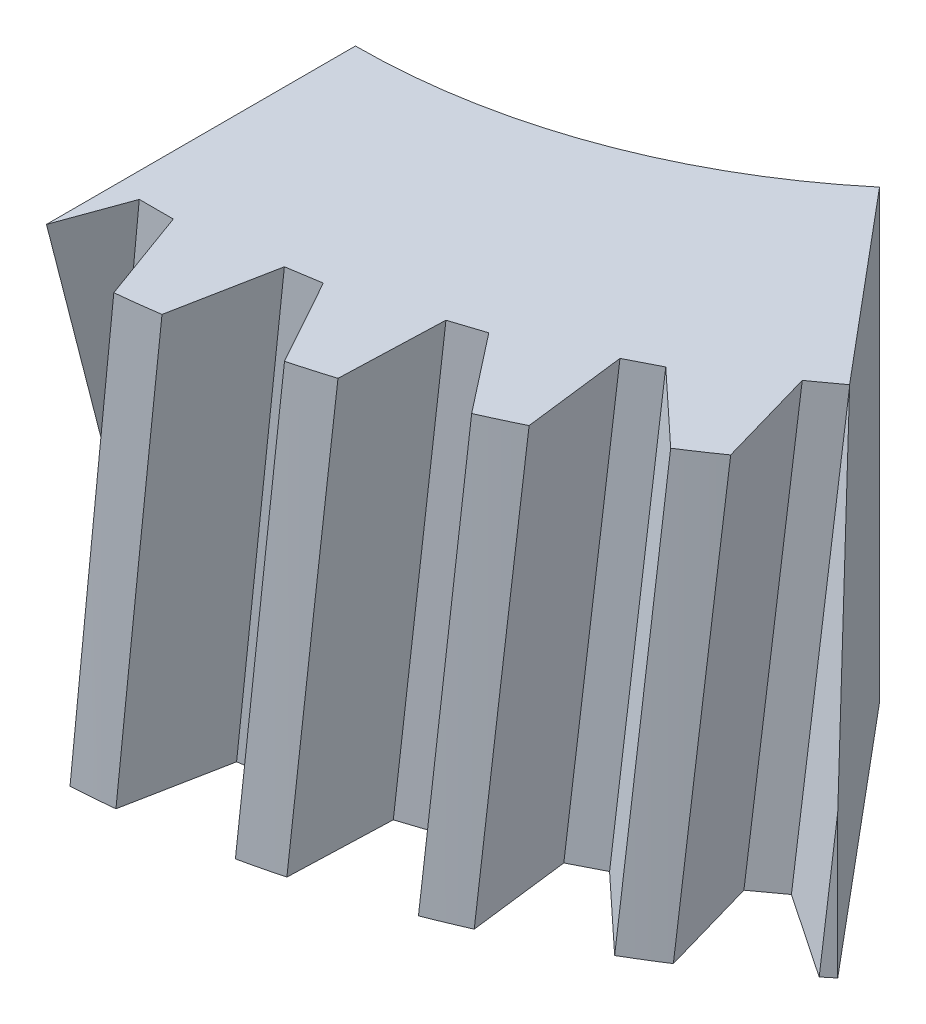
from build123d import *

# Parameters (mm, degrees)
SKETCH_1_R               = 31.5
SKETCH_1_R_2             = 20.1
EXTRUDE_1_DEPTH          = 15
PATTERN_CIRCULAR_4_COUNT = 40
SKETCH_9_OUTSIDE_W       = 83.064
SKETCH_9_OUTSIDE_H       = 83.064
CUT_EXTRUDE_1_DEPTH      = 48.00244519


with BuildPart() as part:
    # Эскиз1 → Бобышка-Вытянуть1 (new body)
    with BuildSketch(Plane(origin=(0, 0, 0), x_dir=(1, 0, 0), z_dir=(0, 1, 0))):
        with Locations(Location((0, 0, 0), (0, 0, 270))):
            Circle(SKETCH_1_R)
        with Locations(Location((0, 0, 0), (0, 0, 270))):
            Circle(SKETCH_1_R_2, mode=Mode.SUBTRACT)
    extrude(amount=EXTRUDE_1_DEPTH)

    # Вырез-По траектории4: sweep along a path in Эскиз8
    with BuildLine(Plane(origin=(30, 0, 0), x_dir=(0, 0, -1), z_dir=(1, 0, 0))) as sweep_4_path:
        Line((0, 0), (1.610154635, 17.19379209))
    # Эскиз7 → Вырез-По траектории4 (sweep, cut)
    with BuildSketch(Plane(origin=(0, 0, 0), x_dir=(1, 0, 0), z_dir=(0, 1, 0))):
        Polygon((28.2, -0.57191311), (28.2, 0.57191311), (32, 1.955), (32, -1.955), align=None)
    sweep_4 = sweep(path=sweep_4_path.line, mode=Mode.SUBTRACT)

    # Круговой массив4: Вырез-По траектории4 ×40 about axis
    pattern_circular_4_axis = Axis((0, 0, 0), (0, 1, 0))
    for i in range(1, PATTERN_CIRCULAR_4_COUNT):
        add(sweep_4.rotate(pattern_circular_4_axis, i * 360 / PATTERN_CIRCULAR_4_COUNT), mode=Mode.SUBTRACT)

    # Эскиз9 outside → Вырез-Вытянуть1 (cut, through all)
    with BuildSketch(Plane(origin=(0, 15, 0), x_dir=(1, 0, 0), z_dir=(0, 1, 0))):
        Rectangle(SKETCH_9_OUTSIDE_W, SKETCH_9_OUTSIDE_H)
        with BuildLine():
            Line((0, 0), (0, -31.5))
            ThreePointArc((0, -31.5), (10.773634515, -29.600317555), (20.247809705, -24.130399958))
            Line((20.247809705, -24.130399958), (0, 0))
        make_face(mode=Mode.SUBTRACT)
    extrude(amount=-CUT_EXTRUDE_1_DEPTH, mode=Mode.SUBTRACT)


solid = part.part
